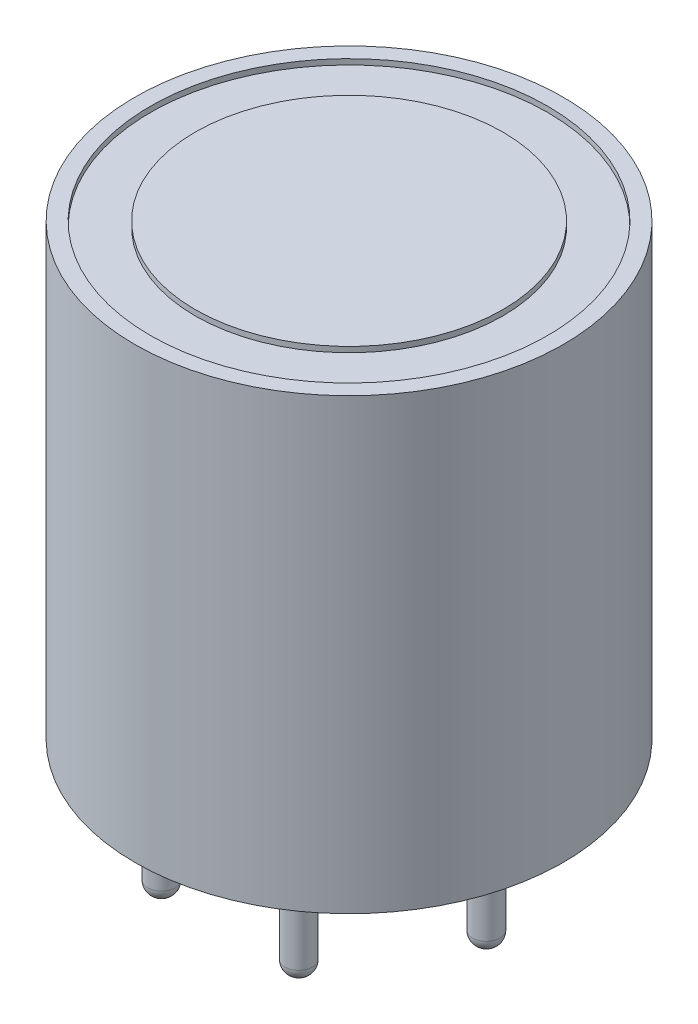
from build123d import *

# Parameters (mm, degrees)
SKETCH1_R           = 11.7
BOSS_EXTRUDE1_DEPTH = 24.5
SKETCH2_R           = 10.85
CUT_EXTRUDE1_DEPTH  = 0.3
SKETCH3_R           = 8.4
BOSS_EXTRUDE2_DEPTH = 0.3
SKETCH6_R           = 0.75
BOSS_EXTRUDE3_DEPTH = 6
FILLET12_R          = 0.7


with BuildPart() as part:
    # Sketch1 → Boss-Extrude1 (new body)
    with BuildSketch(Plane(origin=(0, 0, 0), x_dir=(1, 0, 0), z_dir=(0, 1, 0))):
        with Locations(Location((0, 0, 0), (0, 0, 270))):
            Circle(SKETCH1_R)
    extrude(amount=BOSS_EXTRUDE1_DEPTH)

    # Sketch2 → Cut-Extrude1 (cut)
    with BuildSketch(Plane(origin=(0, 24.5, 0), x_dir=(1, 0, 0), z_dir=(0, 1, 0))):
        with Locations(Location((0, 0, 0), (0, 0, 270))):
            Circle(SKETCH2_R)
    extrude(amount=-CUT_EXTRUDE1_DEPTH, mode=Mode.SUBTRACT)

    # Sketch3 → Boss-Extrude2 (add)
    with BuildSketch(Plane(origin=(0, 24.2, 0), x_dir=(1, 0, 0), z_dir=(0, 1, 0))):
        with Locations(Location((0, 0, 0), (0, 0, 270))):
            Circle(SKETCH3_R)
    extrude(amount=BOSS_EXTRUDE2_DEPTH)

    # Sketch6 → Boss-Extrude3 (add)
    with BuildSketch(Plane.XZ):
        with Locations(Location((7.5, 0, 0), (0, 0, 90))):
            Circle(SKETCH6_R)
        with Locations(Location((3.75, 6.495190528, 0), (0, 0, 90))):
            Circle(SKETCH6_R)
        with Locations(Location((-3.75, 6.495190528, 0), (0, 0, 90))):
            Circle(SKETCH6_R)
        with Locations(Location((3.75, -6.495190528, 0), (0, 0, 90))):
            Circle(SKETCH6_R)
        with Locations(Location((-3.75, -6.495190528, 0), (0, 0, 90))):
            Circle(SKETCH6_R)
    extrude(amount=BOSS_EXTRUDE3_DEPTH)

    # Fillet12
    fillet12_edges = [part.edges().sort_by_distance(p)[0] for p in [
        (7.5, -6, -0.75),
        (3.75, -6, 5.745190528),
        (-3.75, -6, 5.745190528),
        (3.75, -6, -7.245190528),
        (-3.75, -6, -7.245190528),
    ]]
    fillet(fillet12_edges, radius=FILLET12_R)


solid = part.part
